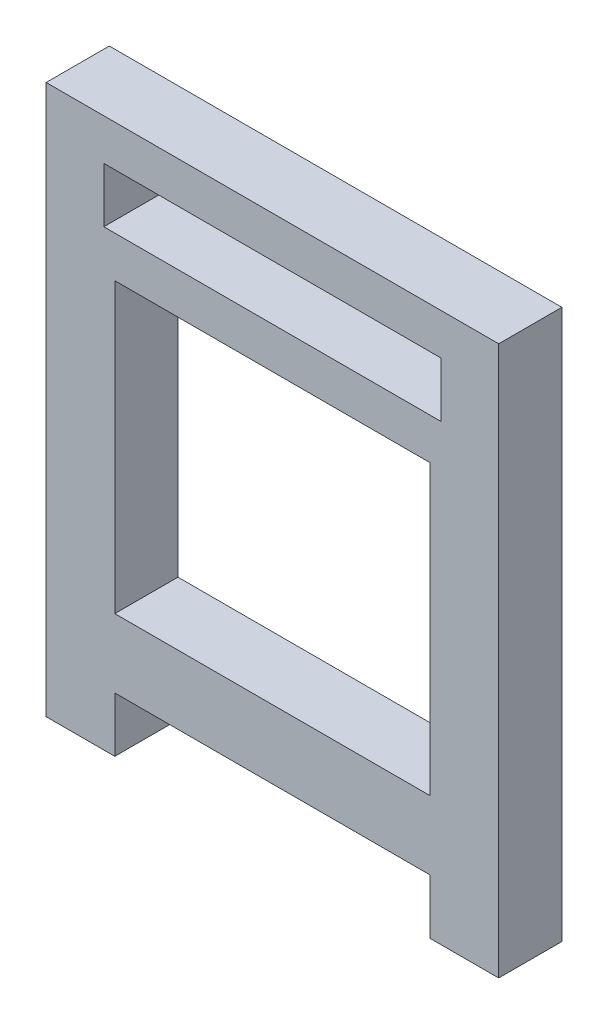
from build123d import *

# Parameters (mm, degrees)
SKETCH1_W           = 11.48
SKETCH1_H           = 10.5
SKETCH1_W_2         = 12.28
SKETCH1_H_2         = 2
BOSS_EXTRUDE1_DEPTH = 2.3


with BuildPart() as part:
    # Sketch1 → Boss-Extrude1 (new body)
    with BuildSketch(Plane.XY):
        Polygon((0, 0), (0, -2), (2.5, -2), (2.5, 0), (13.98, 0), (13.98, -2), (16.48, -2), (16.48, 0), (16.48, 18), (0, 18), align=None)
        with Locations((8.24, 7.75)):
            Rectangle(SKETCH1_W, SKETCH1_H, mode=Mode.SUBTRACT)
        with Locations((8.24, 15.5)):
            Rectangle(SKETCH1_W_2, SKETCH1_H_2, mode=Mode.SUBTRACT)
    extrude(amount=BOSS_EXTRUDE1_DEPTH)


solid = part.part
